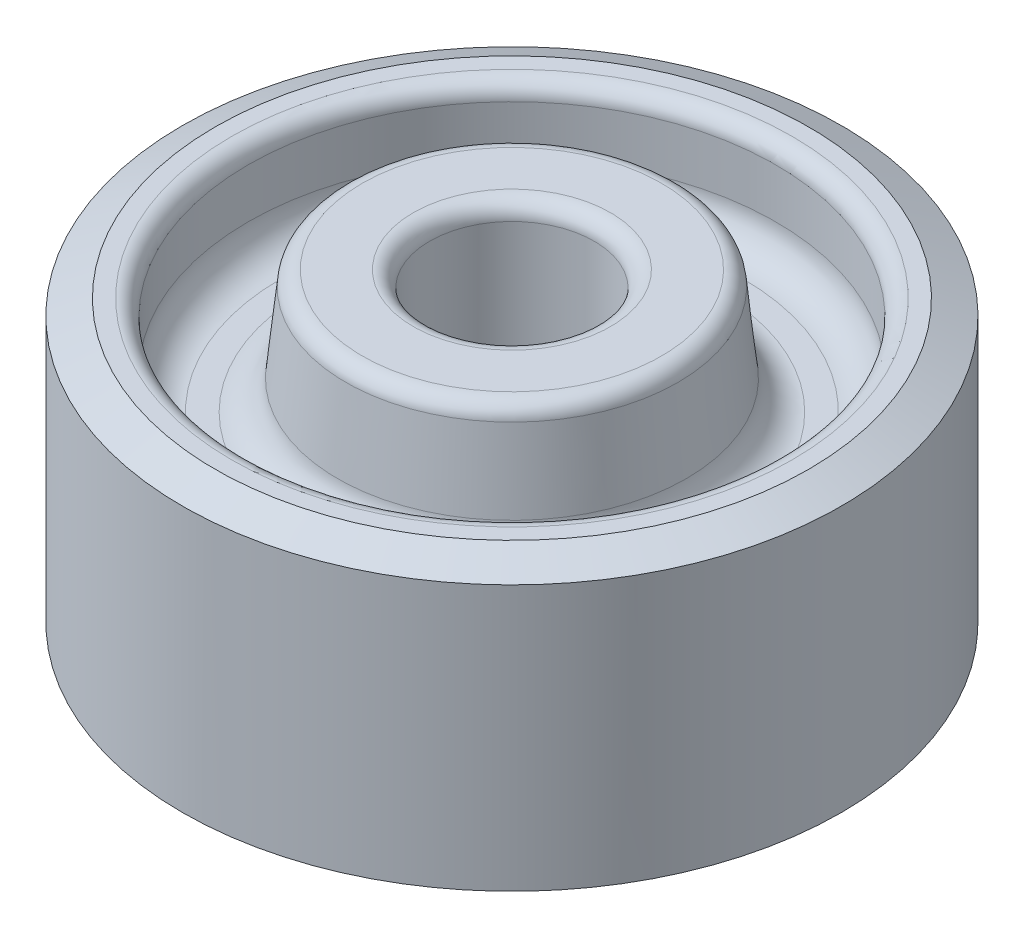
from build123d import *

# Parameters (mm, degrees)
FILLET1_R      = 2
FILLET2_R      = 1
CHAMFER1_SIZE  = 2
CHAMFER1_SIZE2 = 0.932615316
CHAMFER2_SIZE  = 2
CHAMFER2_SIZE2 = 0.932615316


with BuildPart() as part:
    # Sketch1 → Revolve1 (revolve)
    with BuildSketch(Plane.XY):
        Polygon((-5, 10.5), (-10, 10.5), (-10.788281764, 3), (-16.038281764, 3), (-16.038281764, 9), (-20.038281764, 9), (-20.038281764, -9), (-16.038281764, -9), (-16.038281764, -3), (-10.788281764, -3), (-10, -10.5), (-5, -10.5), align=None)
    revolve(axis=Axis((0, 10.5, 0), (0, -1, 0)))

    # Fillet1
    fillet1_edges = [part.edges().sort_by_distance(p)[0] for p in [
        (16.038281764, -3, 0),
        (10.788281764, -3, 0),
        (10.788281764, 3, 0),
        (16.038281764, 3, 0),
    ]]
    fillet(fillet1_edges, radius=FILLET1_R)

    # Fillet2
    fillet2_edges = [part.edges().sort_by_distance(p)[0] for p in [
        (16.038281764, 9, 0),
        (16.038281764, -9, 0),
        (10, -10.5, 0),
        (5, -10.5, 0),
        (5, 10.5, 0),
        (10, 10.5, 0),
    ]]
    fillet(fillet2_edges, radius=FILLET2_R)

    # Chamfer1
    chamfer1_edges = [part.edges().sort_by_distance(p)[0] for p in [
        (20.038281764, -9, 0),
    ]]
    chamfer1_side = [part.faces().sort_by_distance(p)[0] for p in [
        (17.605049961, -9, 0),
    ]]
    chamfer(chamfer1_edges, length=CHAMFER1_SIZE, length2=CHAMFER1_SIZE2, reference=chamfer1_side[0])

    # Chamfer2
    chamfer2_edges = [part.edges().sort_by_distance(p)[0] for p in [
        (20.038281764, 9, 0),
    ]]
    chamfer2_side = [part.faces().sort_by_distance(p)[0] for p in [
        (17.605049961, 9, 0),
    ]]
    chamfer(chamfer2_edges, length=CHAMFER2_SIZE, length2=CHAMFER2_SIZE2, reference=chamfer2_side[0])


solid = part.part
